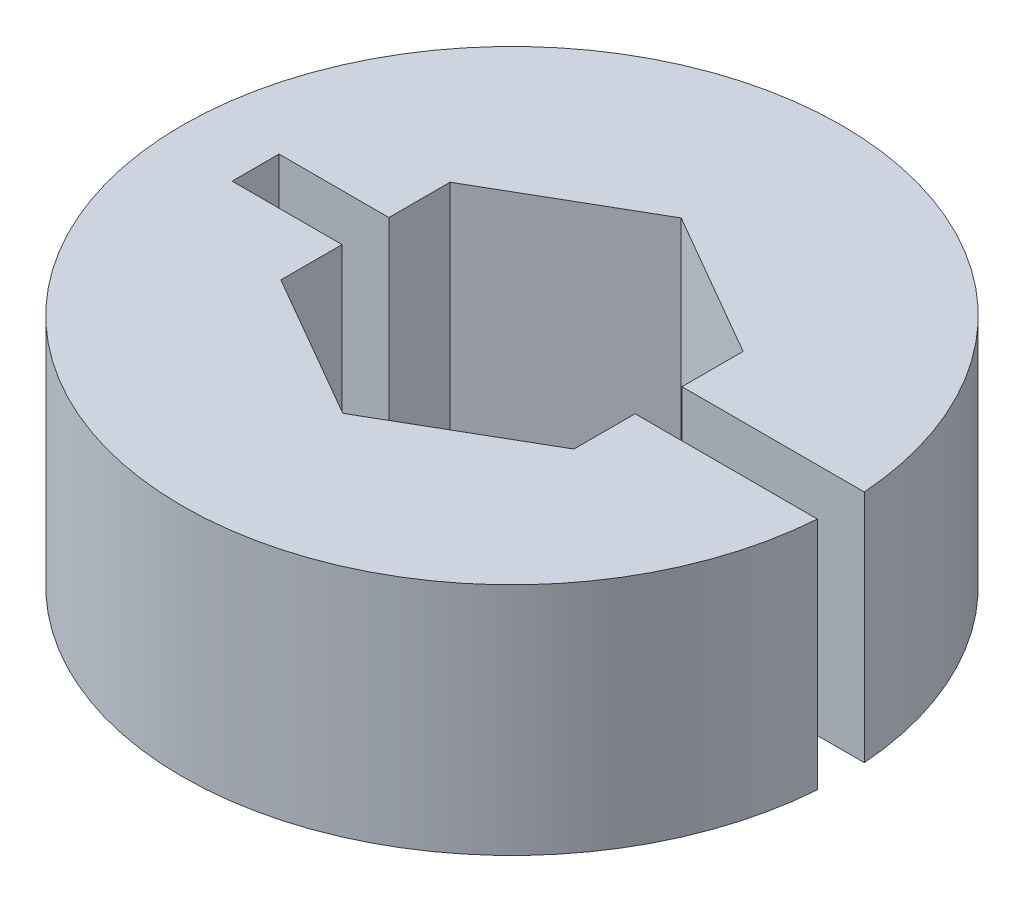
from build123d import *

# Parameters (mm, degrees)
SKETCH1_R           = 14.2875
BOSS_EXTRUDE1_DEPTH = 10.16
CUT_EXTRUDE1_DEPTH  = 23.61616485
SKETCH3_W           = 25.4
SKETCH3_H           = 2.032
CUT_EXTRUDE2_DEPTH  = 23.61616485


with BuildPart() as part:
    # Sketch1 → Boss-Extrude1 (new body)
    with BuildSketch(Plane(origin=(0, 0, 0), x_dir=(1, 0, 0), z_dir=(0, 1, 0))):
        with Locations(Location((0, 0, 0), (0, 0, 270))):
            Circle(SKETCH1_R)
    extrude(amount=BOSS_EXTRUDE1_DEPTH)

    # Sketch2 → Cut-Extrude1 (cut, through all)
    with BuildSketch(Plane(origin=(0, 10.16, 0), x_dir=(1, 0, 0), z_dir=(0, 1, 0))):
        Polygon((0, 7.332348419), (-6.35, 3.666174209), (-6.35, -3.666174209), (0, -7.332348419), (6.35, -3.666174209), (6.35, 3.666174209), align=None)
    extrude(amount=-CUT_EXTRUDE1_DEPTH, mode=Mode.SUBTRACT)

    # Sketch3 → Cut-Extrude2 (cut, through all)
    with BuildSketch(Plane(origin=(0, 10.16, 0), x_dir=(1, 0, 0), z_dir=(0, 1, 0))):
        with Locations((1.5875, 0)):
            Rectangle(SKETCH3_W, SKETCH3_H)
    extrude(amount=-CUT_EXTRUDE2_DEPTH, mode=Mode.SUBTRACT)


solid = part.part
